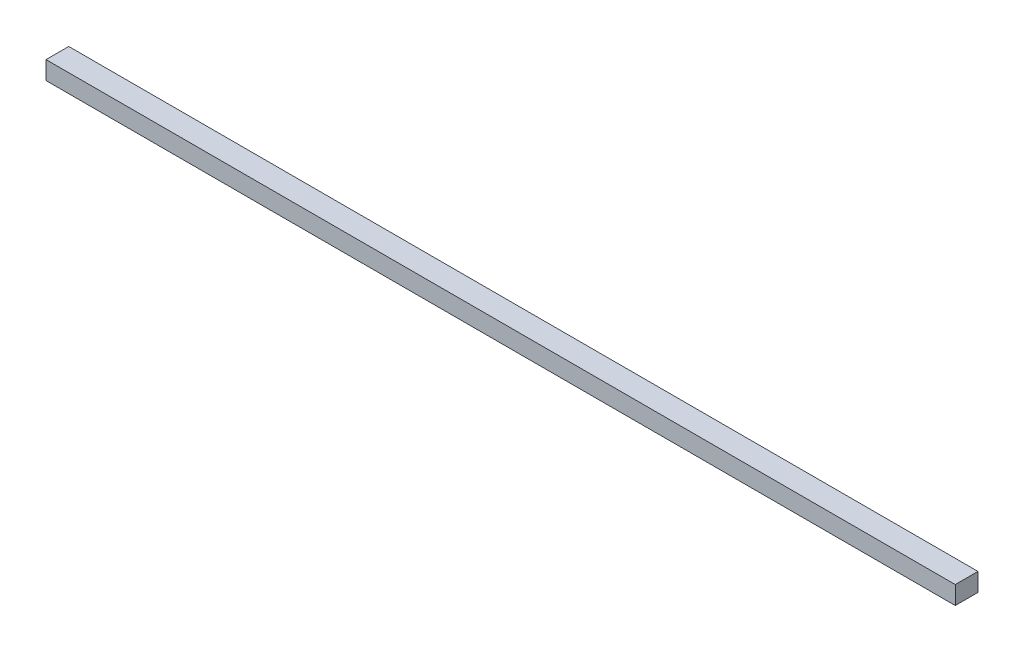
from build123d import *

# Parameters (mm, degrees)
SKETCH_1_W      = 20
SKETCH_1_H      = 16
EXTRUDE_1_DEPTH = 800


with BuildPart() as part:
    # 草图1 → 凸台-拉伸1 (new body)
    with BuildSketch(Plane(origin=(0, 0, 0), x_dir=(0, 0, -1), z_dir=(1, 0, 0))):
        with Locations((-10, 8)):
            Rectangle(SKETCH_1_W, SKETCH_1_H)
    extrude(amount=EXTRUDE_1_DEPTH)


solid = part.part
